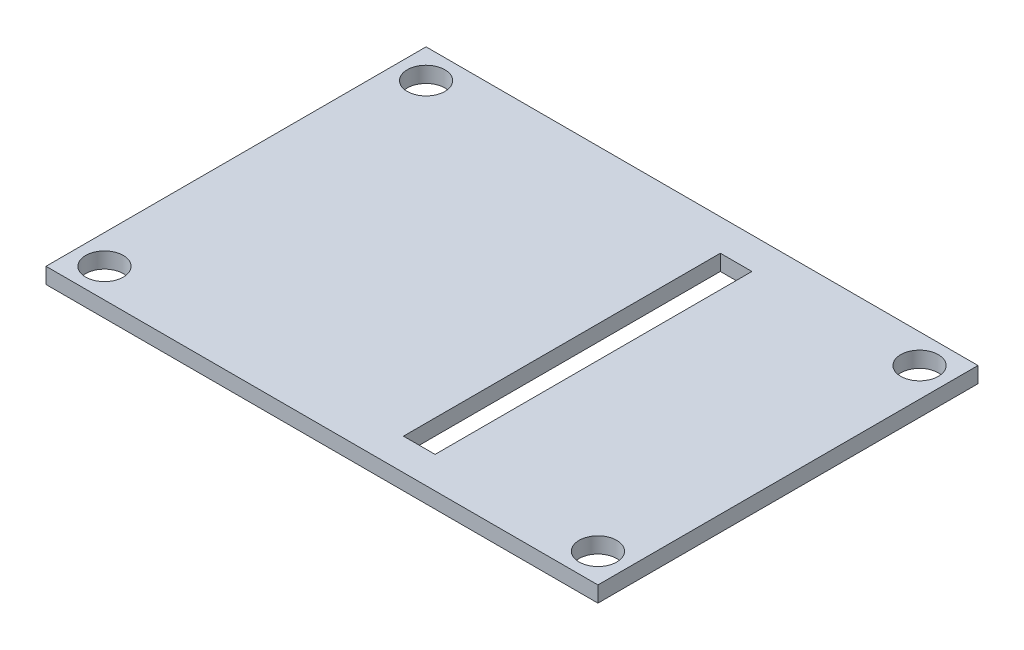
from build123d import *

# Parameters (mm, degrees)
SKETCH1_W           = 69.85
SKETCH1_H           = 48.1
SKETCH1_W_2         = 4
SKETCH1_H_2         = 40.1
BOSS_EXTRUDE1_DEPTH = 2
SKETCH2_R           = 2.38125
CUT_EXTRUDE1_DEPTH  = 2
SKETCH3_R           = 2.38125
CUT_EXTRUDE2_DEPTH  = 2
SKETCH4_R           = 2.38125
CUT_EXTRUDE3_DEPTH  = 2
SKETCH5_R           = 2.38125
CUT_EXTRUDE4_DEPTH  = 2


with BuildPart() as part:
    # Sketch1 → Boss-Extrude1 (new body)
    with BuildSketch(Plane(origin=(0, 0, 0), x_dir=(1, 0, 0), z_dir=(0, 1, 0))):
        with Locations((0.741612582, -9.055777885)):
            Rectangle(SKETCH1_W, SKETCH1_H)
        with Locations((9.056612582, -9.055777885)):
            Rectangle(SKETCH1_W_2, SKETCH1_H_2, mode=Mode.SUBTRACT)
    extrude(amount=BOSS_EXTRUDE1_DEPTH)

    # Sketch2 → Cut-Extrude1 (cut)
    with BuildSketch(Plane(origin=(0, 2, 0), x_dir=(1, 0, 0), z_dir=(0, 1, 0))):
        with Locations(Location((-30.483387418, -29.405777885, 0), (0, 0, 270))):
            Circle(SKETCH2_R)
    extrude(amount=-CUT_EXTRUDE1_DEPTH, mode=Mode.SUBTRACT)

    # Sketch3 → Cut-Extrude2 (cut)
    with BuildSketch(Plane(origin=(0, 2, 0), x_dir=(1, 0, 0), z_dir=(0, 1, 0))):
        with Locations(Location((-30.483387418, 11.294222115, 0), (0, 0, 270))):
            Circle(SKETCH3_R)
    extrude(amount=-CUT_EXTRUDE2_DEPTH, mode=Mode.SUBTRACT)

    # Sketch4 → Cut-Extrude3 (cut)
    with BuildSketch(Plane(origin=(0, 2, 0), x_dir=(1, 0, 0), z_dir=(0, 1, 0))):
        with Locations(Location((31.966612582, -29.405777885, 0), (0, 0, 270))):
            Circle(SKETCH4_R)
    extrude(amount=-CUT_EXTRUDE3_DEPTH, mode=Mode.SUBTRACT)

    # Sketch5 → Cut-Extrude4 (cut)
    with BuildSketch(Plane(origin=(0, 2, 0), x_dir=(1, 0, 0), z_dir=(0, 1, 0))):
        with Locations(Location((31.966612582, 11.294222115, 0), (0, 0, 270))):
            Circle(SKETCH5_R)
    extrude(amount=-CUT_EXTRUDE4_DEPTH, mode=Mode.SUBTRACT)


solid = part.part
